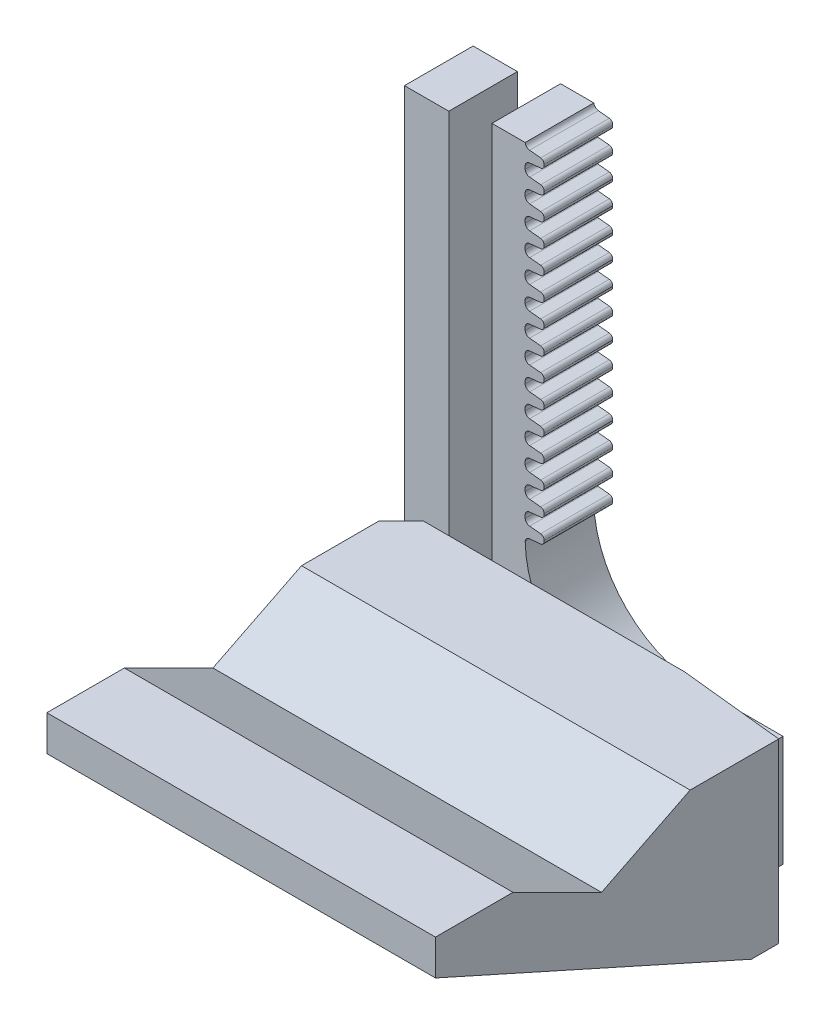
from build123d import *

# Parameters (mm, degrees)
BOSS_EXTRUDE1_DEPTH = 6.2
BOSS_EXTRUDE2_DEPTH = 21
CHAMFER1_SIZE       = 5
CHAMFER1_SIZE2      = 28.356409098
CUT_EXTRUDE1_REACH  = 73.991
CHAMFER2_SIZE       = 1
CHAMFER2_SIZE2      = 9.514364454
CHAMFER3_SIZE       = 2
CUT_EXTRUDE2_REACH  = 78.94
CUT_EXTRUDE3_START  = -3.468867
CUT_EXTRUDE3_DEPTH  = 3.468867
BOSS_EXTRUDE3_DEPTH = 6.2
CUT_EXTRUDE4_REACH  = 78.94


with BuildPart() as part:
    # Sketch1 → Boss-Extrude1 (new body)
    with BuildSketch(Plane.XY):
        with BuildLine():
            Line((-28, 0), (0, 0))
            Line((0, 0), (0, 10))
            Line((0, 10), (-7.1, 10))
            ThreePointArc((-7.1, 10), (-14.171067812, 12.928932188), (-17.1, 20))
            Line((-17.1, 20), (-17.1, 51))
            Line((-17.1, 51), (-20.1, 51))
            Line((-20.1, 51), (-20.1, 6))
            Line((-20.1, 6), (-24, 6))
            Line((-24, 6), (-24, 50))
            Line((-24, 50), (-28, 50))
            Line((-28, 50), (-28, 0))
        make_face()
    extrude(amount=BOSS_EXTRUDE1_DEPTH)

    # Sketch2 → Boss-Extrude2 (add)
    with BuildSketch(Plane.XZ):
        Polygon((0, 6.2), (0, 10.4), (11, 10.4), (11, 42.4), (-24.1, 42.4), (-24.1, 10.4), (-13.1, 10.4), (-13.1, 6.2), align=None)
    extrude(amount=-BOSS_EXTRUDE2_DEPTH)

    # Chamfer1
    chamfer1_edges = [part.edges().sort_by_distance(p)[0] for p in [
        (-6.55, 0, 42.4),
    ]]
    chamfer1_side = [part.faces().sort_by_distance(p)[0] for p in [
        (-6.55, 10.5, 42.4),
    ]]
    chamfer(chamfer1_edges, length=CHAMFER1_SIZE, length2=CHAMFER1_SIZE2, reference=chamfer1_side[0])

    # Sketch3 → Cut-Extrude1 (cut, up to next)
    with BuildSketch(Plane(origin=(0, 0, 0), x_dir=(0, 0, -1), z_dir=(1, 0, 0)), mode=Mode.PRIVATE) as cut_extrude1_sk1:
        Polygon((-6.2, 10), (-7.6, 10), (-10.4, 21), (-6.2, 21), align=None)
    cut_extrude1_tool1 = extrude(cut_extrude1_sk1.sketch, amount=-CUT_EXTRUDE1_REACH, mode=Mode.PRIVATE) & part.part
    add(cut_extrude1_tool1.solids().sort_by_distance((0, 16.416667, 7.716667))[0], mode=Mode.SUBTRACT)

    # Chamfer2
    chamfer2_edges = [part.edges().sort_by_distance(p)[0] for p in [
        (11, 10.5, 10.4),
    ]]
    chamfer2_side = [part.faces().sort_by_distance(p)[0] for p in [
        (11, 11.541747932, 25.62778603),
    ]]
    chamfer(chamfer2_edges, length=CHAMFER2_SIZE, length2=CHAMFER2_SIZE2, reference=chamfer2_side[0])

    # Chamfer3
    chamfer3_edges = [part.edges().sort_by_distance(p)[0] for p in [
        (-24.1, 10.5, 10.4),
    ]]
    chamfer(chamfer3_edges, length=CHAMFER3_SIZE)

    # Sketch5 → Cut-Extrude2 (cut, up to next)
    with BuildSketch(Plane(origin=(11, 0, 0), x_dir=(0, 0, -1), z_dir=(1, 0, 0)), mode=Mode.PRIVATE) as cut_extrude2_sk1:
        Polygon((-42.4, 17.8), (-13.86886709, 5), (-10.966215349, -4.108657177), (-44.036924755, 0.937700744), align=None)
    cut_extrude2_tool1 = extrude(cut_extrude2_sk1.sketch, amount=-CUT_EXTRUDE2_REACH, mode=Mode.PRIVATE) & part.part
    add(cut_extrude2_tool1.solids().sort_by_distance((11, 5.258773, 29.627692))[0], mode=Mode.SUBTRACT)

    # Sketch6 → Cut-Extrude3 (cut)
    with BuildSketch(Plane(origin=(0, 0, 10.4), x_dir=(-1, 0, 0), z_dir=(0, 0, -1)).offset(CUT_EXTRUDE3_START)):
        Polygon((13.1, 0), (24.1, 5), (37.198342989, 5), (28.62602328, -4.522208447), (-13.825974113, -5.629287686), (-20.705007466, 5), (-11, 5), (0, 0), align=None)
    extrude(amount=CUT_EXTRUDE3_DEPTH, mode=Mode.SUBTRACT)

    # Sketch7 → Boss-Extrude3 (add)
    with BuildSketch(Plane.XY.offset(6.2)):
        with BuildLine():
            Line((-16.7, 50.6), (-15.7, 50.5))
            ThreePointArc((-15.7, 50.5), (-15.462165524, 50.365875857), (-15.4, 50.1))
            ThreePointArc((-15.4, 50.1), (-15.462165524, 49.834124143), (-15.7, 49.7))
            Line((-15.7, 49.7), (-16.7, 49.6))
            ThreePointArc((-16.7, 49.6), (-16.971392676, 49.471392676), (-17.1, 49.2))
            Line((-17.1, 49.2), (-17.1, 48.9))
            ThreePointArc((-17.1, 48.9), (-16.971392676, 48.628607324), (-16.7, 48.5))
            Line((-16.7, 48.5), (-15.7, 48.4))
            ThreePointArc((-15.7, 48.4), (-15.462165524, 48.265875857), (-15.4, 48))
            ThreePointArc((-15.4, 48), (-15.462165524, 47.734124143), (-15.7, 47.6))
            Line((-15.7, 47.6), (-16.7, 47.5))
            ThreePointArc((-16.7, 47.5), (-16.971392676, 47.371392676), (-17.1, 47.1))
            Line((-17.1, 47.1), (-17.1, 46.8))
            ThreePointArc((-17.1, 46.8), (-16.971392676, 46.528607324), (-16.7, 46.4))
            Line((-16.7, 46.4), (-15.7, 46.3))
            ThreePointArc((-15.7, 46.3), (-15.462165524, 46.165875857), (-15.4, 45.9))
            ThreePointArc((-15.4, 45.9), (-15.462165524, 45.634124143), (-15.7, 45.5))
            Line((-15.7, 45.5), (-16.7, 45.4))
            ThreePointArc((-16.7, 45.4), (-16.971392676, 45.271392676), (-17.1, 45))
            Line((-17.1, 45), (-17.1, 44.7))
            ThreePointArc((-17.1, 44.7), (-16.971392676, 44.428607324), (-16.7, 44.3))
            Line((-16.7, 44.3), (-15.7, 44.2))
            ThreePointArc((-15.7, 44.2), (-15.462165524, 44.065875857), (-15.4, 43.8))
            ThreePointArc((-15.4, 43.8), (-15.462165524, 43.534124143), (-15.7, 43.4))
            Line((-15.7, 43.4), (-16.7, 43.3))
            ThreePointArc((-16.7, 43.3), (-16.971392676, 43.171392676), (-17.1, 42.9))
            Line((-17.1, 42.9), (-17.1, 42.6))
            ThreePointArc((-17.1, 42.6), (-16.971392676, 42.328607324), (-16.7, 42.2))
            Line((-16.7, 42.2), (-15.7, 42.1))
            ThreePointArc((-15.7, 42.1), (-15.462165524, 41.965875857), (-15.4, 41.7))
            ThreePointArc((-15.4, 41.7), (-15.462165524, 41.434124143), (-15.7, 41.3))
            Line((-15.7, 41.3), (-16.7, 41.2))
            ThreePointArc((-16.7, 41.2), (-16.971392676, 41.071392676), (-17.1, 40.8))
            Line((-17.1, 40.8), (-17.1, 40.5))
            ThreePointArc((-17.1, 40.5), (-16.971392676, 40.228607324), (-16.7, 40.1))
            Line((-16.7, 40.1), (-15.7, 40))
            ThreePointArc((-15.7, 40), (-15.462165524, 39.865875857), (-15.4, 39.6))
            ThreePointArc((-15.4, 39.6), (-15.462165524, 39.334124143), (-15.7, 39.2))
            Line((-15.7, 39.2), (-16.7, 39.1))
            ThreePointArc((-16.7, 39.1), (-16.971392676, 38.971392676), (-17.1, 38.7))
            Line((-17.1, 38.7), (-17.1, 38.4))
            ThreePointArc((-17.1, 38.4), (-16.971392676, 38.128607324), (-16.7, 38))
            Line((-16.7, 38), (-15.7, 37.9))
            ThreePointArc((-15.7, 37.9), (-15.462165524, 37.765875857), (-15.4, 37.5))
            ThreePointArc((-15.4, 37.5), (-15.462165524, 37.234124143), (-15.7, 37.1))
            Line((-15.7, 37.1), (-16.7, 37))
            ThreePointArc((-16.7, 37), (-16.971392676, 36.871392676), (-17.1, 36.6))
            Line((-17.1, 36.6), (-17.1, 36.3))
            ThreePointArc((-17.1, 36.3), (-16.971392676, 36.028607324), (-16.7, 35.9))
            Line((-16.7, 35.9), (-15.7, 35.8))
            ThreePointArc((-15.7, 35.8), (-15.462165524, 35.665875857), (-15.4, 35.4))
            ThreePointArc((-15.4, 35.4), (-15.462165524, 35.134124143), (-15.7, 35))
            Line((-15.7, 35), (-16.7, 34.9))
            ThreePointArc((-16.7, 34.9), (-16.971392676, 34.771392676), (-17.1, 34.5))
            Line((-17.1, 34.5), (-17.1, 34.2))
            ThreePointArc((-17.1, 34.2), (-16.971392676, 33.928607324), (-16.7, 33.8))
            Line((-16.7, 33.8), (-15.7, 33.7))
            ThreePointArc((-15.7, 33.7), (-15.462165524, 33.565875857), (-15.4, 33.3))
            ThreePointArc((-15.4, 33.3), (-15.462165524, 33.034124143), (-15.7, 32.9))
            Line((-15.7, 32.9), (-16.7, 32.8))
            ThreePointArc((-16.7, 32.8), (-16.971392676, 32.671392676), (-17.1, 32.4))
            Line((-17.1, 32.4), (-17.1, 32.1))
            ThreePointArc((-17.1, 32.1), (-16.971392676, 31.828607324), (-16.7, 31.7))
            Line((-16.7, 31.7), (-15.7, 31.6))
            ThreePointArc((-15.7, 31.6), (-15.462165524, 31.465875857), (-15.4, 31.2))
            ThreePointArc((-15.4, 31.2), (-15.462165524, 30.934124143), (-15.7, 30.8))
            Line((-15.7, 30.8), (-16.7, 30.7))
            ThreePointArc((-16.7, 30.7), (-16.971392676, 30.571392676), (-17.1, 30.3))
            Line((-17.1, 30.3), (-17.1, 30))
            ThreePointArc((-17.1, 30), (-16.971392676, 29.728607324), (-16.7, 29.6))
            Line((-16.7, 29.6), (-15.7, 29.5))
            ThreePointArc((-15.7, 29.5), (-15.462165524, 29.365875857), (-15.4, 29.1))
            ThreePointArc((-15.4, 29.1), (-15.462165524, 28.834124143), (-15.7, 28.7))
            Line((-15.7, 28.7), (-16.7, 28.6))
            ThreePointArc((-16.7, 28.6), (-16.971392676, 28.471392676), (-17.1, 28.2))
            Line((-17.1, 28.2), (-17.1, 27.9))
            ThreePointArc((-17.1, 27.9), (-16.971392676, 27.628607324), (-16.7, 27.5))
            Line((-16.7, 27.5), (-15.7, 27.4))
            ThreePointArc((-15.7, 27.4), (-15.462165524, 27.265875857), (-15.4, 27))
            ThreePointArc((-15.4, 27), (-15.462165524, 26.734124143), (-15.7, 26.6))
            Line((-15.7, 26.6), (-16.7, 26.5))
            ThreePointArc((-16.7, 26.5), (-16.971392676, 26.371392676), (-17.1, 26.1))
            Line((-17.1, 26.1), (-17.1, 25.8))
            ThreePointArc((-17.1, 25.8), (-16.971392676, 25.528607324), (-16.7, 25.4))
            Line((-16.7, 25.4), (-15.7, 25.3))
            ThreePointArc((-15.7, 25.3), (-15.462165524, 25.165875857), (-15.4, 24.9))
            ThreePointArc((-15.4, 24.9), (-15.462165524, 24.634124143), (-15.7, 24.5))
            Line((-15.7, 24.5), (-16.7, 24.4))
            ThreePointArc((-16.7, 24.4), (-16.971392676, 24.271392676), (-17.1, 24))
            Line((-17.1, 24), (-17.1, 23.7))
            ThreePointArc((-17.1, 23.7), (-16.971392676, 23.428607324), (-16.7, 23.3))
            Line((-16.7, 23.3), (-15.7, 23.2))
            ThreePointArc((-15.7, 23.2), (-15.462165524, 23.065875857), (-15.4, 22.8))
            ThreePointArc((-15.4, 22.8), (-15.462165524, 22.534124143), (-15.7, 22.4))
            Line((-15.7, 22.4), (-16.7, 22.3))
            ThreePointArc((-16.7, 22.3), (-16.971392676, 22.171392676), (-17.1, 21.9))
            Line((-17.1, 21.9), (-17.1, 21.6))
            ThreePointArc((-17.1, 21.6), (-16.971392676, 21.328607324), (-16.7, 21.2))
            Line((-16.7, 21.2), (-15.7, 21.1))
            ThreePointArc((-15.7, 21.1), (-15.462165524, 20.965875857), (-15.4, 20.7))
            ThreePointArc((-15.4, 20.7), (-15.462165524, 20.434124143), (-15.7, 20.3))
            Line((-15.7, 20.3), (-16.7, 20.2))
            ThreePointArc((-16.7, 20.2), (-16.971392676, 20.071392676), (-17.1, 19.8))
            Line((-17.1, 19.8), (-17.1, 19.5))
            Line((-17.1, 19.5), (-18.637373825, 21.126261745))
            Line((-18.637373825, 21.126261745), (-18.815, 46.4))
            Line((-18.815, 46.4), (-17.1, 51))
            ThreePointArc((-17.1, 51), (-16.971392676, 50.728607324), (-16.7, 50.6))
        make_face()
    extrude(amount=-BOSS_EXTRUDE3_DEPTH)

    # Sketch8 → Cut-Extrude4 (cut, up to next)
    with BuildSketch(Plane(origin=(11, 0, 0), x_dir=(0, 0, -1), z_dir=(1, 0, 0)), mode=Mode.PRIVATE) as cut_extrude4_sk1:
        Polygon((-35.4, 21), (-27.4, 17), (-19.4, 21), align=None)
    cut_extrude4_tool1 = extrude(cut_extrude4_sk1.sketch, amount=-CUT_EXTRUDE4_REACH, mode=Mode.PRIVATE) & part.part
    add(cut_extrude4_tool1.solids().sort_by_distance((11, 19.666667, 27.4))[0], mode=Mode.SUBTRACT)


solid = part.part
